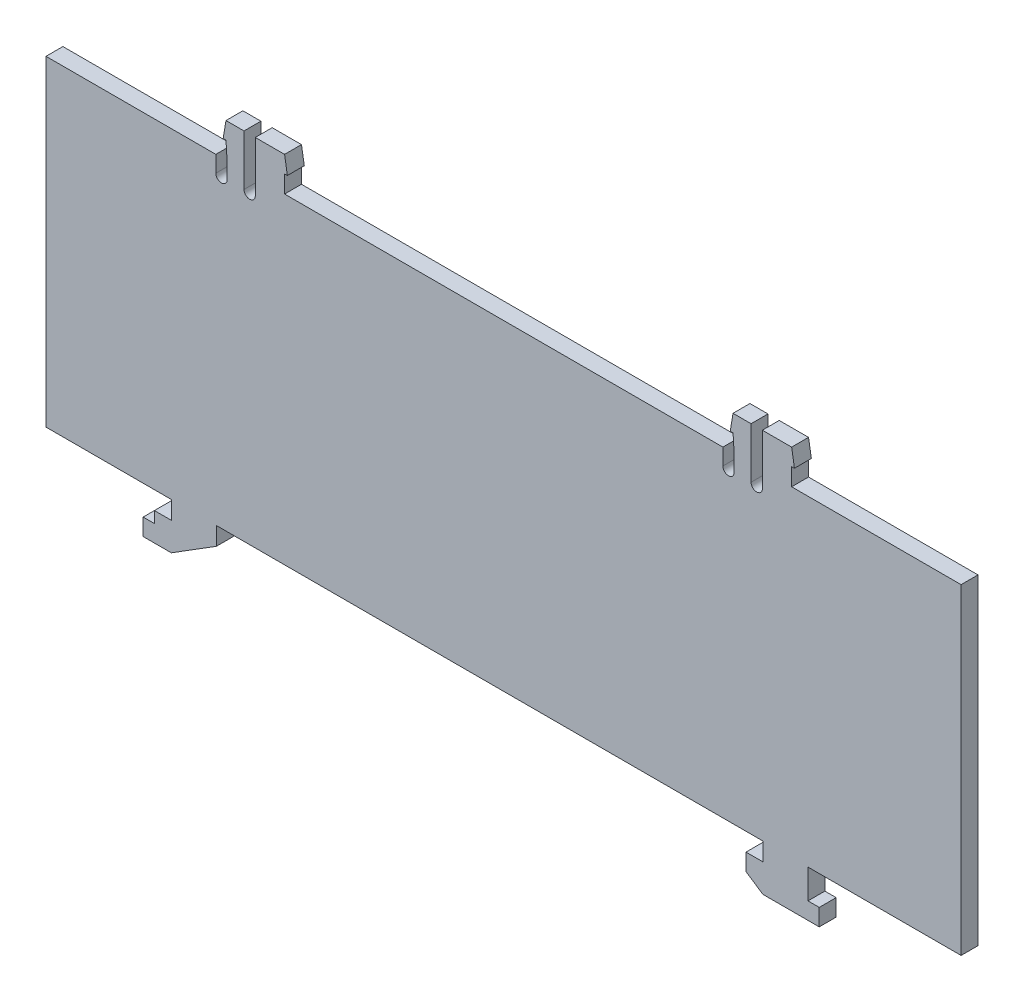
from build123d import *

# Parameters (mm, degrees)
SKETCH1_W            = 162.421633227
SKETCH1_H            = 57
BOSS_EXTRUDE1_DEPTH  = 3
BOTTOM_HOOKS_DEPTH   = 3
TOP_TABS_DEPTH       = 3
TOP_TAB_RELIEF_REACH = 107.556


with BuildPart() as part:
    # Sketch1 → Boss-Extrude1 (new body)
    with BuildSketch(Plane.XY):
        with Locations((-1.032340883, 31.5)):
            Rectangle(SKETCH1_W, SKETCH1_H)
    extrude(amount=BOSS_EXTRUDE1_DEPTH)

    # Sketch2 → bottom hooks (add)
    with BuildSketch(Plane(origin=(0, 0, 0), x_dir=(-1, 0, 0), z_dir=(0, 0, -1))):
        Polygon((52, 3), (60, 3), (60, -0.2), (63, -0.2), (63, -2.2), (65, -2.2), (65, -5.2), (60, -5.2), (52, -0.2), align=None)
        Polygon((-53, -2.2), (-55, -2.2), (-55, -5.2), (-45, -5.2), (-42, -3.2), (-42, -0.2), (-45, -0.2), (-45, 3), (-53, 3), align=None)
    extrude(amount=-BOTTOM_HOOKS_DEPTH)

    # Sketch3 → top tabs (add)
    with BuildSketch(Plane(origin=(0, 0, 0), x_dir=(-1, 0, 0), z_dir=(0, 0, -1))):
        with BuildLine():
            Line((-39.7, 63.1), (-39.9, 60))
            Line((-39.9, 60), (-39.9, 57.1))
            ThreePointArc((-39.9, 57.1), (-38.9, 56.1), (-37.9, 57.1))
            Line((-37.9, 57.1), (-37.9, 60))
            Line((-37.9, 60), (-35.9, 60))
            Line((-35.9, 60), (-35.9, 53))
            Line((-35.9, 53), (-52.1, 53))
            Line((-52.1, 53), (-52.1, 60))
            Line((-52.1, 60), (-50.1, 60))
            Line((-50.1, 60), (-50.1, 63.1))
            Line((-50.1, 63.1), (-50.6, 63.1))
            Line((-50.6, 63.1), (-50.1, 66.1))
            Line((-50.1, 66.1), (-44.9, 66.1))
            Line((-44.9, 66.1), (-44.9, 57.1))
            ThreePointArc((-44.9, 57.1), (-43.9, 56.1), (-42.9, 57.1))
            Line((-42.9, 57.1), (-42.9, 66.1))
            Line((-42.9, 66.1), (-39.7, 66.1))
            Line((-39.7, 66.1), (-39.2, 63.1))
            Line((-39.2, 63.1), (-39.7, 63.1))
        make_face()
        with BuildLine():
            Line((50.3, 63.1), (50.1, 60))
            Line((50.1, 60), (50.1, 57.1))
            ThreePointArc((50.1, 57.1), (51.1, 56.1), (52.1, 57.1))
            Line((52.1, 57.1), (52.1, 60))
            Line((52.1, 60), (54.1, 60))
            Line((54.1, 60), (54.1, 53))
            Line((54.1, 53), (37.9, 53))
            Line((37.9, 53), (37.9, 60))
            Line((37.9, 60), (39.9, 60))
            Line((39.9, 60), (39.9, 63.1))
            Line((39.9, 63.1), (39.4, 63.1))
            Line((39.4, 63.1), (39.9, 66.1))
            Line((39.9, 66.1), (45.1, 66.1))
            Line((45.1, 66.1), (45.1, 57.1))
            ThreePointArc((45.1, 57.1), (46.1, 56.1), (47.1, 57.1))
            Line((47.1, 57.1), (47.1, 66.1))
            Line((47.1, 66.1), (50.3, 66.1))
            Line((50.3, 66.1), (50.8, 63.1))
            Line((50.8, 63.1), (50.3, 63.1))
        make_face()
    extrude(amount=-TOP_TABS_DEPTH)

    # Sketch4 → top tab relief (cut, up to next)
    with BuildSketch(Plane(origin=(0, 0, 0), x_dir=(-1, 0, 0), z_dir=(0, 0, -1)), mode=Mode.PRIVATE) as top_tab_relief_sk1:
        with BuildLine():
            Line((47.1, 57.1), (47.1, 66.1))
            Line((47.1, 66.1), (45.1, 66.1))
            Line((45.1, 66.1), (45.1, 57.1))
            ThreePointArc((45.1, 57.1), (46.1, 56.1), (47.1, 57.1))
        make_face()
    top_tab_relief_tool1 = extrude(top_tab_relief_sk1.sketch, amount=-TOP_TAB_RELIEF_REACH, mode=Mode.PRIVATE) & part.part
    # Sketch4 → top tab relief (cut, up to next)
    with BuildSketch(Plane(origin=(0, 0, 0), x_dir=(-1, 0, 0), z_dir=(0, 0, -1)), mode=Mode.PRIVATE) as top_tab_relief_sk2:
        with BuildLine():
            Line((50.1, 60), (50.1, 57.1))
            ThreePointArc((50.1, 57.1), (51.1, 56.1), (52.1, 57.1))
            Line((52.1, 57.1), (52.1, 60))
            Line((52.1, 60), (50.1, 60))
        make_face()
    top_tab_relief_tool2 = extrude(top_tab_relief_sk2.sketch, amount=-TOP_TAB_RELIEF_REACH, mode=Mode.PRIVATE) & part.part
    # Sketch4 → top tab relief (cut, up to next)
    with BuildSketch(Plane(origin=(0, 0, 0), x_dir=(-1, 0, 0), z_dir=(0, 0, -1)), mode=Mode.PRIVATE) as top_tab_relief_sk3:
        with BuildLine():
            Line((-44.9, 66.1), (-44.9, 57.1))
            ThreePointArc((-44.9, 57.1), (-43.9, 56.1), (-42.9, 57.1))
            Line((-42.9, 57.1), (-42.9, 66.1))
            Line((-42.9, 66.1), (-44.9, 66.1))
        make_face()
    top_tab_relief_tool3 = extrude(top_tab_relief_sk3.sketch, amount=-TOP_TAB_RELIEF_REACH, mode=Mode.PRIVATE) & part.part
    # Sketch4 → top tab relief (cut, up to next)
    with BuildSketch(Plane(origin=(0, 0, 0), x_dir=(-1, 0, 0), z_dir=(0, 0, -1)), mode=Mode.PRIVATE) as top_tab_relief_sk4:
        with BuildLine():
            Line((-39.9, 60), (-39.9, 57.1))
            ThreePointArc((-39.9, 57.1), (-38.9, 56.1), (-37.9, 57.1))
            Line((-37.9, 57.1), (-37.9, 60))
            Line((-37.9, 60), (-39.9, 60))
        make_face()
    top_tab_relief_tool4 = extrude(top_tab_relief_sk4.sketch, amount=-TOP_TAB_RELIEF_REACH, mode=Mode.PRIVATE) & part.part
    add(top_tab_relief_tool1.solids().sort_by_distance((-46.1, 61.204755, 0))[0], mode=Mode.SUBTRACT)
    add(top_tab_relief_tool2.solids().sort_by_distance((-51.1, 58.150542, 0))[0], mode=Mode.SUBTRACT)
    add(top_tab_relief_tool3.solids().sort_by_distance((43.9, 61.204755, 0))[0], mode=Mode.SUBTRACT)
    add(top_tab_relief_tool4.solids().sort_by_distance((38.9, 58.150542, 0))[0], mode=Mode.SUBTRACT)


solid = part.part
